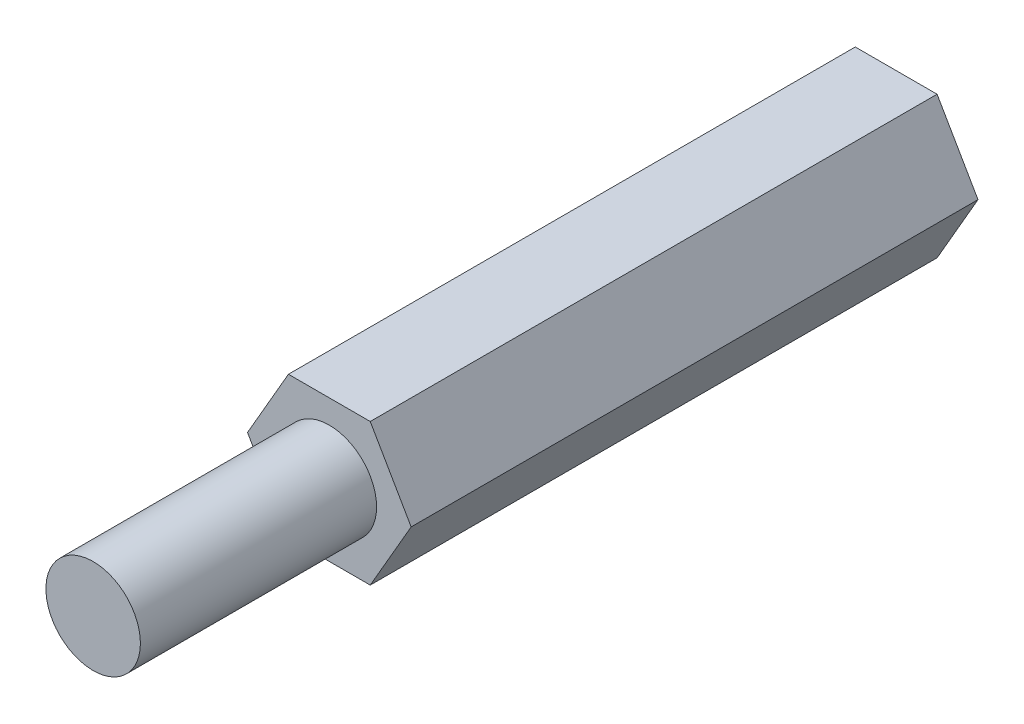
from build123d import *

# Parameters (mm, degrees)
EXTRUDE_1_DEPTH        = 12
SKETCH_2_R             = 1
EXTRUDE_2_DEPTH        = 5
HOLE_WIZARD_M2_1_D     = 2.4
HOLE_WIZARD_M2_1_DEPTH = 3
HOLE_WIZARD_M2_1_TIP   = 0.721032743


with BuildPart() as part:
    # 스케치1 → 보스-돌출1 (new body)
    with BuildSketch(Plane.XY):
        Polygon((0.866025404, -1.5), (1.732050808, 0), (0.866025404, 1.5), (-0.866025404, 1.5), (-1.732050808, 0), (-0.866025404, -1.5), align=None)
    extrude(amount=EXTRUDE_1_DEPTH)

    # 스케치2 → 보스-돌출2 (add)
    with BuildSketch(Plane.XY.offset(12)):
        Circle(SKETCH_2_R)
    extrude(amount=EXTRUDE_2_DEPTH)

    # M2 여유 구멍1
    with Locations(Plane(origin=(0, 0, 0), x_dir=(-1, 0, 0), z_dir=(0, 0, -1))):
        with Locations((0, 0)):
            Hole(HOLE_WIZARD_M2_1_D / 2, depth=HOLE_WIZARD_M2_1_DEPTH)
            with Locations((0, 0, -(HOLE_WIZARD_M2_1_DEPTH + HOLE_WIZARD_M2_1_TIP / 2))):  # 118° drill point
                Cone(0, HOLE_WIZARD_M2_1_D / 2, HOLE_WIZARD_M2_1_TIP, mode=Mode.SUBTRACT)


solid = part.part
